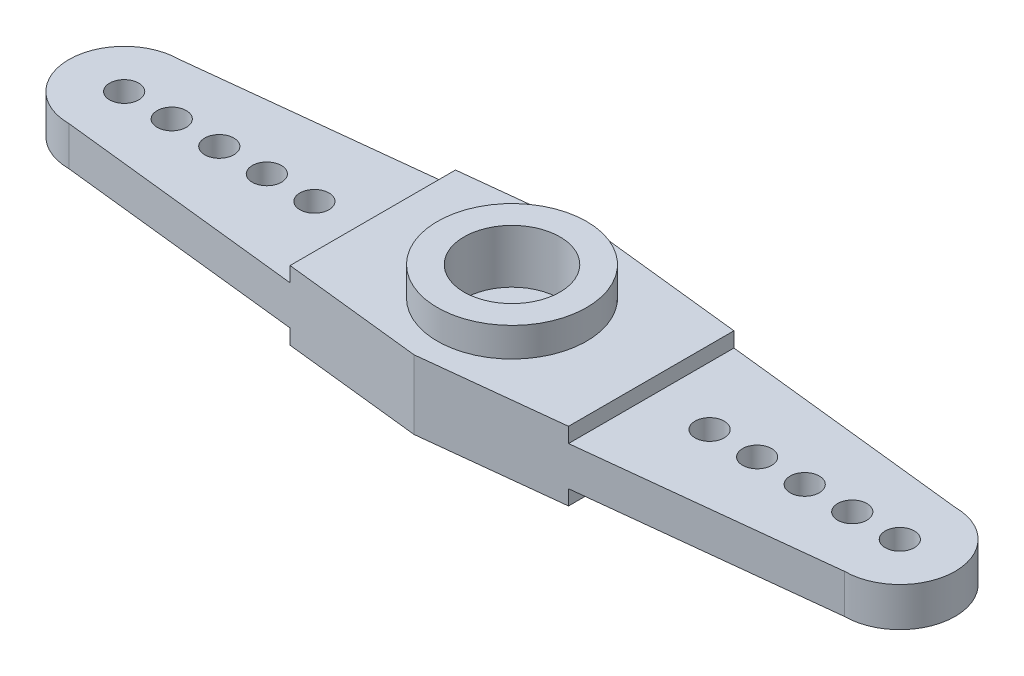
from build123d import *

# Parameters (mm, degrees)
SKETCH1_R                = 0.95
BOSS_EXTRUDE1_DEPTH      = 2.55
BOSS_EXTRUDE2_DEPTH      = 0.975
BOSS_EXTRUDE2_DEPTH_BACK = 3.525
SKETCH3_R                = 4.135
CUT_EXTRUDE1_DEPTH       = 1.95
SKETCH4_R                = 4.865
BOSS_EXTRUDE3_DEPTH      = 1.9
SKETCH5_R                = 3.125
CUT_EXTRUDE2_DEPTH       = 3.49


with BuildPart() as part:
    # Sketch1 → Boss-Extrude1 (new body)
    with BuildSketch(Plane(origin=(0, 0, 0), x_dir=(1, 0, 0), z_dir=(0, 1, 0))):
        with BuildLine():
            Line((0, 12.78), (25.28, 10))
            ThreePointArc((25.28, 10), (28.89, 6.39), (25.28, 2.78))
            Line((25.28, 2.78), (0, 0))
            Line((0, 0), (-25.28, 2.78))
            ThreePointArc((-25.28, 2.78), (-28.89, 6.39), (-25.28, 10))
            Line((-25.28, 10), (0, 12.78))
        make_face()
        with Locations(Location((25.28, 6.39, 0), (0, 0, 270))):
            Circle(SKETCH1_R, mode=Mode.SUBTRACT)
        with Locations(Location((22.18, 6.39, 0), (0, 0, 270))):
            Circle(SKETCH1_R, mode=Mode.SUBTRACT)
        with Locations(Location((19.08, 6.39, 0), (0, 0, 270))):
            Circle(SKETCH1_R, mode=Mode.SUBTRACT)
        with Locations(Location((15.98, 6.39, 0), (0, 0, 270))):
            Circle(SKETCH1_R, mode=Mode.SUBTRACT)
        with Locations(Location((12.88, 6.39, 0), (0, 0, 270))):
            Circle(SKETCH1_R, mode=Mode.SUBTRACT)
        with Locations(Location((-12.88, 6.39, 0), (0, 0, 90))):
            Circle(SKETCH1_R, mode=Mode.SUBTRACT)
        with Locations(Location((-15.98, 6.39, 0), (0, 0, 90))):
            Circle(SKETCH1_R, mode=Mode.SUBTRACT)
        with Locations(Location((-19.08, 6.39, 0), (0, 0, 90))):
            Circle(SKETCH1_R, mode=Mode.SUBTRACT)
        with Locations(Location((-22.18, 6.39, 0), (0, 0, 90))):
            Circle(SKETCH1_R, mode=Mode.SUBTRACT)
        with Locations(Location((-25.28, 6.39, 0), (0, 0, 90))):
            Circle(SKETCH1_R, mode=Mode.SUBTRACT)
    extrude(amount=BOSS_EXTRUDE1_DEPTH)

    # Sketch2 → Boss-Extrude2 (add, two sides: drawn at the far end of the back side and taken through both)
    with BuildSketch(Plane(origin=(0, 2.55, 0), x_dir=(1, 0, 0), z_dir=(0, 1, 0)).offset(-BOSS_EXTRUDE2_DEPTH_BACK)):
        Polygon((-9.075, 11.782037184), (-9.075, 0.997962816), (0, 0), (9.075, 0.997962816), (9.075, 11.782037184), (0, 12.78), align=None)
    extrude(amount=BOSS_EXTRUDE2_DEPTH + BOSS_EXTRUDE2_DEPTH_BACK)

    # Sketch3 → Cut-Extrude1 (cut)
    with BuildSketch(Plane.XZ.offset(0.975)):
        with Locations(Location((0, -6.39, 0), (0, 0, 270))):
            Circle(SKETCH3_R)
    extrude(amount=-CUT_EXTRUDE1_DEPTH, mode=Mode.SUBTRACT)

    # Sketch4 → Boss-Extrude3 (add)
    with BuildSketch(Plane(origin=(0, 3.525, 0), x_dir=(1, 0, 0), z_dir=(0, 1, 0))):
        with Locations(Location((0, 6.39, 0), (0, 0, 90))):
            Circle(SKETCH4_R)
    extrude(amount=BOSS_EXTRUDE3_DEPTH)

    # Sketch5 → Cut-Extrude2 (cut)
    with BuildSketch(Plane(origin=(0, 5.425, 0), x_dir=(1, 0, 0), z_dir=(0, 1, 0))):
        with Locations(Location((0, 6.39, 0), (0, 0, 270))):
            Circle(SKETCH5_R)
    extrude(amount=-CUT_EXTRUDE2_DEPTH, mode=Mode.SUBTRACT)


solid = part.part
